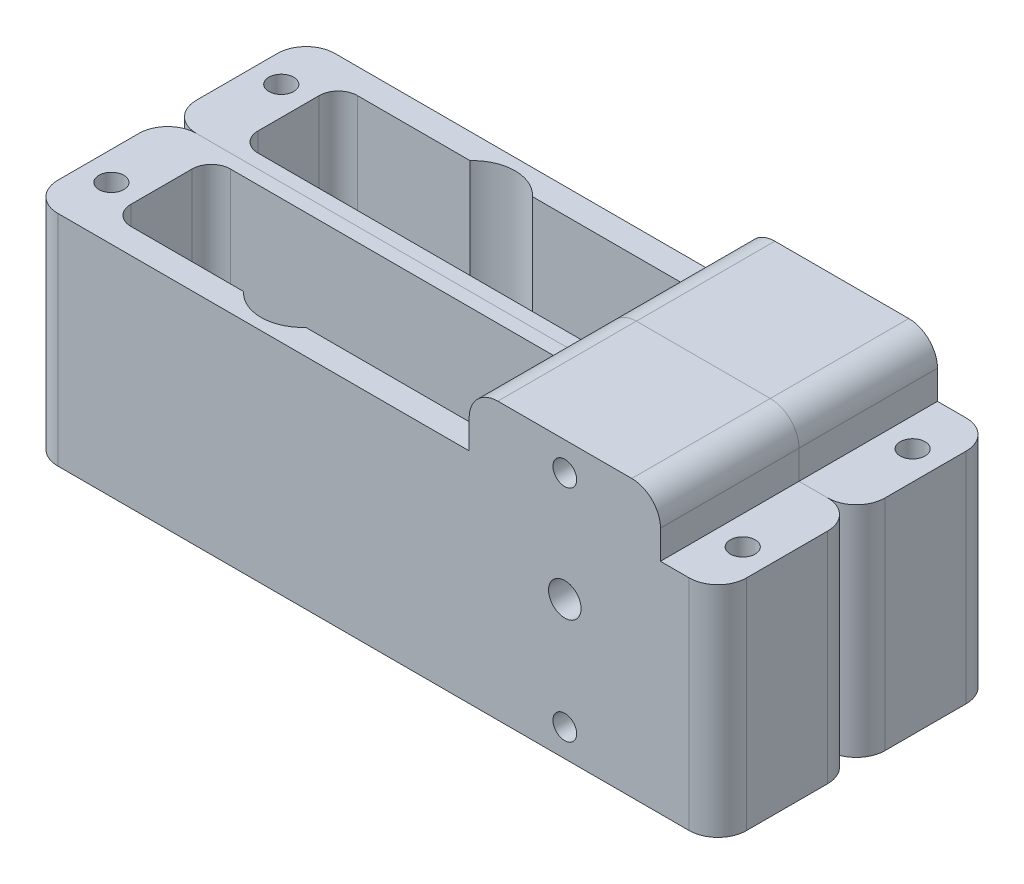
from build123d import *

# Parameters (mm, degrees)
SKETCH1_W           = 180
SKETCH1_H           = 57.2
SKETCH1_W_2         = 50
SKETCH1_H_2         = 15
BOSS_EXTRUDE1_DEPTH = 36.2
SKETCH2_R           = 3.25
SKETCH2_R_2         = 5.75
SKETCH2_R_3         = 1.75
CUT_EXTRUDE1_DEPTH  = 57.2
FILLET1_R           = 7.5
CUT_EXTRUDE3_START  = -52.2
SKETCH3_R           = 1.75
SKETCH3_R_2         = 5.75
CUT_EXTRUDE3_DEPTH  = 52.2
SKETCH4_W           = 43.7
SKETCH4_H           = 42.2
SKETCH4_R           = 4.25
CUT_EXTRUDE4_DEPTH  = 33.2
SKETCH4_3_R         = 4.25
CUT_EXTRUDE5_DEPTH  = 36.2
SKETCH7_R           = 3.1
CUT_EXTRUDE7_DEPTH  = 36.2
FILLET2_R           = 7.5
BOSS_EXTRUDE3_DEPTH = 22.4
BOSS_EXTRUDE4_START = 33.2
SKETCH8_W           = 43.7
SKETCH8_H           = 42.2
SKETCH8_R           = 4.25
BOSS_EXTRUDE4_DEPTH = 33.2


with BuildPart() as part:
    # Sketch1 → Boss-Extrude1 (new body)
    with BuildSketch(Plane.XY):
        Rectangle(SKETCH1_W, SKETCH1_H)
        with Locations((50, 36.1)):
            Rectangle(SKETCH1_W_2, SKETCH1_H_2)
    extrude(amount=BOSS_EXTRUDE1_DEPTH)

    # Sketch2 → Cut-Extrude1 (cut)
    with BuildSketch(Plane.XZ.offset(28.6)):
        with Locations(Location((-82.5, 14, 0), (0, 0, 270))):
            Circle(SKETCH2_R)
        with Locations(Location((-32.4, 14, 0), (0, 0, 270))):
            Circle(SKETCH2_R_2)
        with Locations(Location((-38.056854249, 19.656854249, 0), (0, 0, 270))):
            Circle(SKETCH2_R_3)
        with Locations(Location((-26.743145751, 19.656854249, 0), (0, 0, 270))):
            Circle(SKETCH2_R_3)
        with Locations(Location((-38.056854249, 8.343145751, 0), (0, 0, 270))):
            Circle(SKETCH2_R_3)
        with Locations(Location((-26.743145751, 8.343145751, 0), (0, 0, 270))):
            Circle(SKETCH2_R_3)
        with Locations(Location((82.5, 14, 0), (0, 0, 270))):
            Circle(SKETCH2_R)
    extrude(amount=-CUT_EXTRUDE1_DEPTH, mode=Mode.SUBTRACT)

    # Fillet1
    fillet1_edges = [part.edges().sort_by_distance(p)[0] for p in [
        (-90, 0, 0),
        (90, 0, 0),
        (-90, 0, 36.2),
        (90, 0, 36.2),
    ]]
    fillet(fillet1_edges, radius=FILLET1_R)

    # Sketch3 → Cut-Extrude3 (cut)
    with BuildSketch(Plane(origin=(0, 28.6, 0), x_dir=(1, 0, 0), z_dir=(0, 1, 0)).offset(CUT_EXTRUDE3_START)):
        with BuildLine():
            Line((-40.532558646, -6.593145751), (-70, -6.593145751))
            ThreePointArc((-70, -6.593145751), (-73.535533906, -8.057611845), (-75, -11.593145751))
            Line((-75, -11.593145751), (-75, -27.6))
            ThreePointArc((-75, -27.6), (-73.535533906, -31.135533906), (-70, -32.6))
            Line((-70, -32.6), (25, -32.6))
            Line((25, -32.6), (25, -6.593145751))
            Line((25, -6.593145751), (-24.267441354, -6.593145751))
            ThreePointArc((-24.267441354, -6.593145751), (-32.4, -3), (-40.532558646, -6.593145751))
        make_face()
        with Locations(Location((-26.743145751, -8.343145751, 0), (0, 0, 90))):
            Circle(SKETCH3_R, mode=Mode.SUBTRACT)
        with Locations(Location((-38.056854249, -19.656854249, 0), (0, 0, 90))):
            Circle(SKETCH3_R, mode=Mode.SUBTRACT)
        with Locations(Location((-26.743145751, -19.656854249, 0), (0, 0, 90))):
            Circle(SKETCH3_R, mode=Mode.SUBTRACT)
        with Locations(Location((-38.056854249, -8.343145751, 0), (0, 0, 90))):
            Circle(SKETCH3_R, mode=Mode.SUBTRACT)
        with Locations(Location((-32.4, -14, 0), (0, 0, 90))):
            Circle(SKETCH3_R_2, mode=Mode.SUBTRACT)
    extrude(amount=CUT_EXTRUDE3_DEPTH, mode=Mode.SUBTRACT)

    # Sketch4 → Cut-Extrude4 (cut)
    with BuildSketch(Plane.XY.offset(36.2)):
        with Locations((50.75, 7.5)):
            Rectangle(SKETCH4_W, SKETCH4_H)
        with Locations((50, 7.5)):
            Circle(SKETCH4_R, mode=Mode.SUBTRACT)
    extrude(amount=-CUT_EXTRUDE4_DEPTH, mode=Mode.SUBTRACT)

    # Sketch4<3> → Cut-Extrude5 (cut)
    with BuildSketch(Plane.XY.offset(36.2)):
        with Locations((50, 7.5)):
            Circle(SKETCH4_3_R)
    extrude(amount=-CUT_EXTRUDE5_DEPTH, mode=Mode.SUBTRACT)

    # Sketch7 → Cut-Extrude7 (cut)
    with BuildSketch(Plane.XY.offset(36.2)):
        with Locations((50, -21.4)):
            Circle(SKETCH7_R)
        with Locations((50, 36.1)):
            Circle(SKETCH7_R)
    extrude(amount=-CUT_EXTRUDE7_DEPTH, mode=Mode.SUBTRACT)

    # Fillet2
    fillet2_edges = [part.edges().sort_by_distance(p)[0] for p in [
        (25, 43.6, 18.1),
        (75, 43.6, 18.1),
    ]]
    fillet(fillet2_edges, radius=FILLET2_R)

    # Sketch7 → Boss-Extrude3 (add)
    with BuildSketch(Plane.XY.offset(36.2)):
        with Locations((50, -21.4)):
            Circle(SKETCH7_R)
        with Locations((50, 36.1)):
            Circle(SKETCH7_R)
    extrude(amount=-BOSS_EXTRUDE3_DEPTH)

    # Sketch8 → Boss-Extrude4 (add)
    with BuildSketch(Plane.XY.offset(3).offset(BOSS_EXTRUDE4_START)):
        with Locations((50.75, 7.5)):
            Rectangle(SKETCH8_W, SKETCH8_H)
        with Locations((50, 7.5)):
            Circle(SKETCH8_R, mode=Mode.SUBTRACT)
    extrude(amount=-BOSS_EXTRUDE4_DEPTH)


with BuildPart() as body_2:
    # Mirror1: mirrored copy
    add(part.part.mirror(Plane.XY.offset(36.2)))


solid = Compound([part.part, body_2.part])
